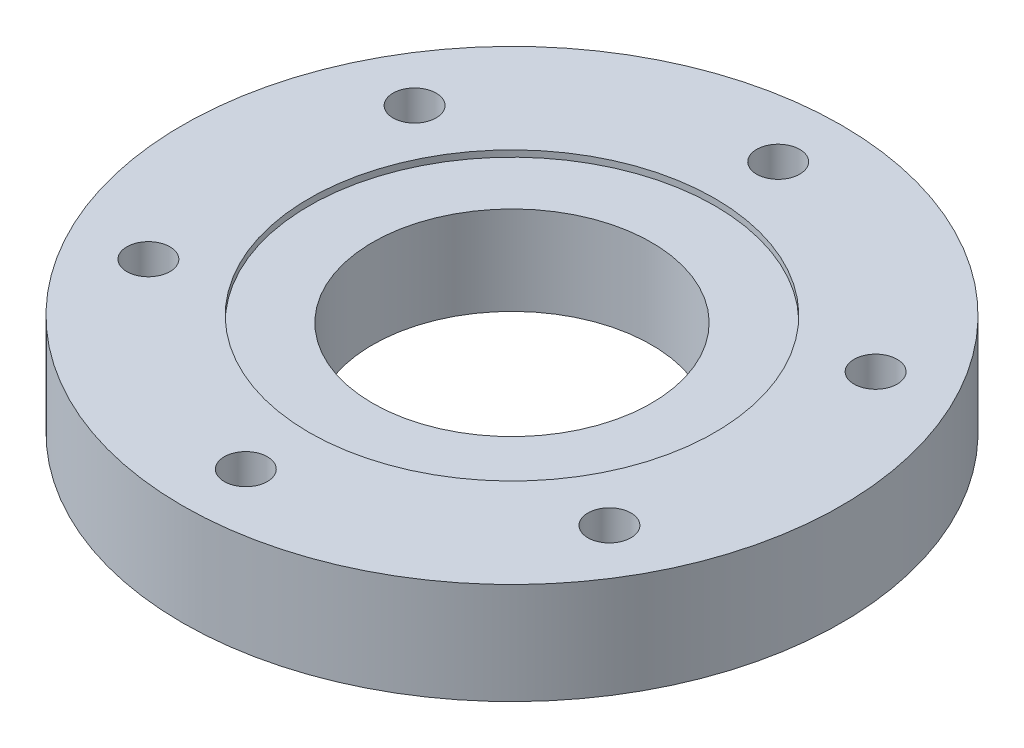
from build123d import *

# Parameters (mm, degrees)
SKETCH_1_R          = 26
SKETCH_1_R_2        = 1.7
SKETCH_1_R_3        = 16
EXTRUDE_1_DEPTH     = 8
SKETCH_2_R          = 3.25
CUT_EXTRUDE_1_DEPTH = 3.3
EXTRUDE_START       = 0.5
SKETCH_3_R          = 16
SKETCH_3_R_2        = 11
EXTRUDE_2_DEPTH     = 7


with BuildPart() as part:
    # 草图1 → 凸台-拉伸1 (new body)
    with BuildSketch(Plane(origin=(0, 0, 0), x_dir=(1, 0, 0), z_dir=(0, 1, 0))):
        with Locations(Location((0, 0, 0), (0, 0, 270))):
            Circle(SKETCH_1_R)
        with Locations(Location((0, 21, 0), (0, 0, 270))):
            Circle(SKETCH_1_R_2, mode=Mode.SUBTRACT)
        with Locations(Location((18.186533479, 10.5, 0), (0, 0, 270))):
            Circle(SKETCH_1_R_2, mode=Mode.SUBTRACT)
        with Locations(Location((18.186533479, -10.5, 0), (0, 0, 270))):
            Circle(SKETCH_1_R_2, mode=Mode.SUBTRACT)
        with Locations(Location((0, -21, 0), (0, 0, 270))):
            Circle(SKETCH_1_R_2, mode=Mode.SUBTRACT)
        with Locations(Location((-18.186533479, -10.5, 0), (0, 0, 270))):
            Circle(SKETCH_1_R_2, mode=Mode.SUBTRACT)
        with Locations(Location((-18.186533479, 10.5, 0), (0, 0, 270))):
            Circle(SKETCH_1_R_2, mode=Mode.SUBTRACT)
        with Locations(Location((0, 0, 0), (0, 0, 270))):
            Circle(SKETCH_1_R_3, mode=Mode.SUBTRACT)
    extrude(amount=EXTRUDE_1_DEPTH)

    # 草图2 → 切除-拉伸1 (cut)
    with BuildSketch(Plane(origin=(0, 0, 0), x_dir=(1, 0, 0), z_dir=(0, 1, 0))):
        with Locations(Location((0, 21, 0), (0, 0, 270))):
            Circle(SKETCH_2_R)
        with Locations(Location((18.186533479, 10.5, 0), (0, 0, 270))):
            Circle(SKETCH_2_R)
        with Locations(Location((18.186533479, -10.5, 0), (0, 0, 270))):
            Circle(SKETCH_2_R)
        with Locations(Location((0, -21, 0), (0, 0, 270))):
            Circle(SKETCH_2_R)
        with Locations(Location((-18.186533479, -10.5, 0), (0, 0, 270))):
            Circle(SKETCH_2_R)
        with Locations(Location((-18.186533479, 10.5, 0), (0, 0, 270))):
            Circle(SKETCH_2_R)
    extrude(amount=CUT_EXTRUDE_1_DEPTH, mode=Mode.SUBTRACT)

    # 草图3 → 凸台-拉伸2 (add)
    with BuildSketch(Plane(origin=(0, 0, 0), x_dir=(1, 0, 0), z_dir=(0, 1, 0)).offset(EXTRUDE_START)):
        with Locations(Location((0, 0, 0), (0, 0, 270))):
            Circle(SKETCH_3_R)
        with Locations(Location((0, 0, 0), (0, 0, 270))):
            Circle(SKETCH_3_R_2, mode=Mode.SUBTRACT)
    extrude(amount=EXTRUDE_2_DEPTH)


solid = part.part
